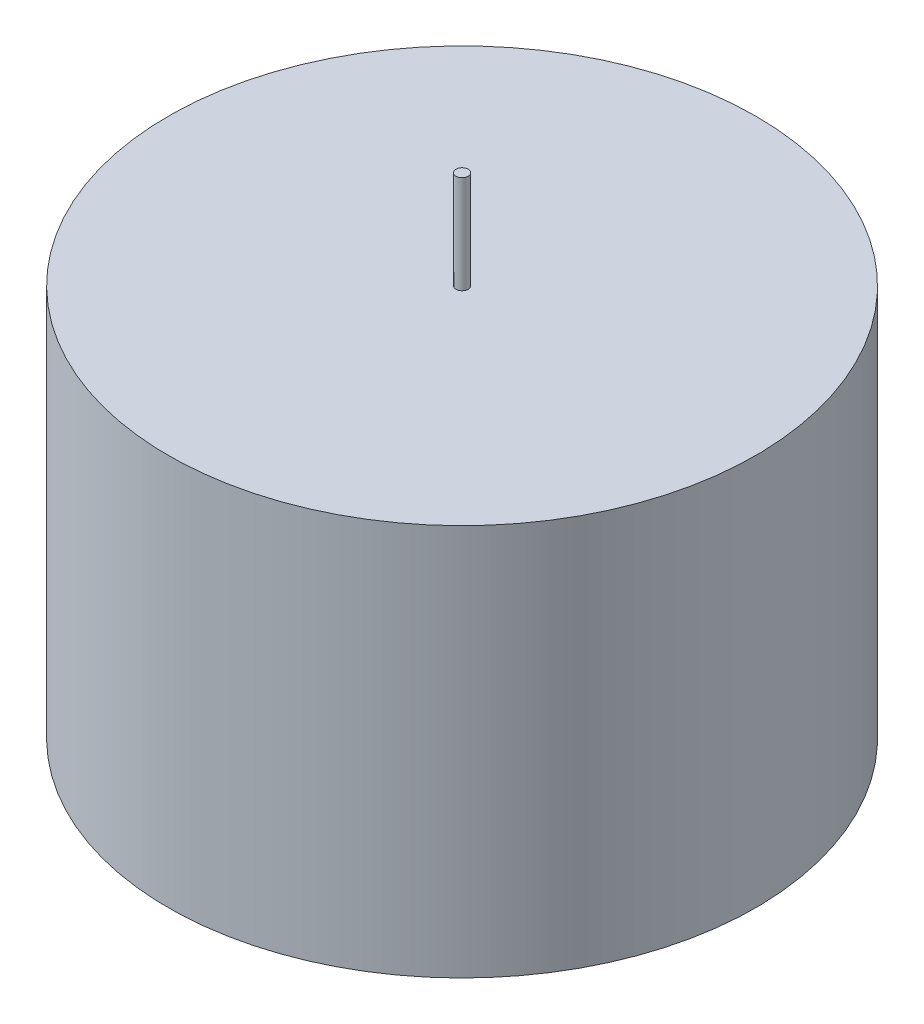
from build123d import *

# Parameters (mm, degrees)
SKETCH1_R                = 457.2
BOSS_EXTRUDE1_DEPTH      = 609.6
BOSS_EXTRUDE2_DEPTH      = 152.4
BOSS_EXTRUDE2_DEPTH_BACK = 762
SKETCH2_R                = 9.525


with BuildPart() as part:
    # Sketch1 → Boss-Extrude1 (new body)
    with BuildSketch(Plane(origin=(0, 0, 0), x_dir=(1, 0, 0), z_dir=(0, 1, 0))):
        with Locations(Location((0, 0, 0), (0, 0, 90))):
            Circle(SKETCH1_R)
    extrude(amount=BOSS_EXTRUDE1_DEPTH)

    # Sketch2 → Boss-Extrude2 (add, two sides: drawn at the far end of the back side and taken through both)
    with BuildSketch(Plane(origin=(0, 609.6, 0), x_dir=(1, 0, 0), z_dir=(0, 1, 0)).offset(-BOSS_EXTRUDE2_DEPTH_BACK)):
        with Locations(Location((0, 0, 0), (0, 0, 270))):
            Circle(SKETCH2_R)
    extrude(amount=BOSS_EXTRUDE2_DEPTH + BOSS_EXTRUDE2_DEPTH_BACK)


solid = part.part
